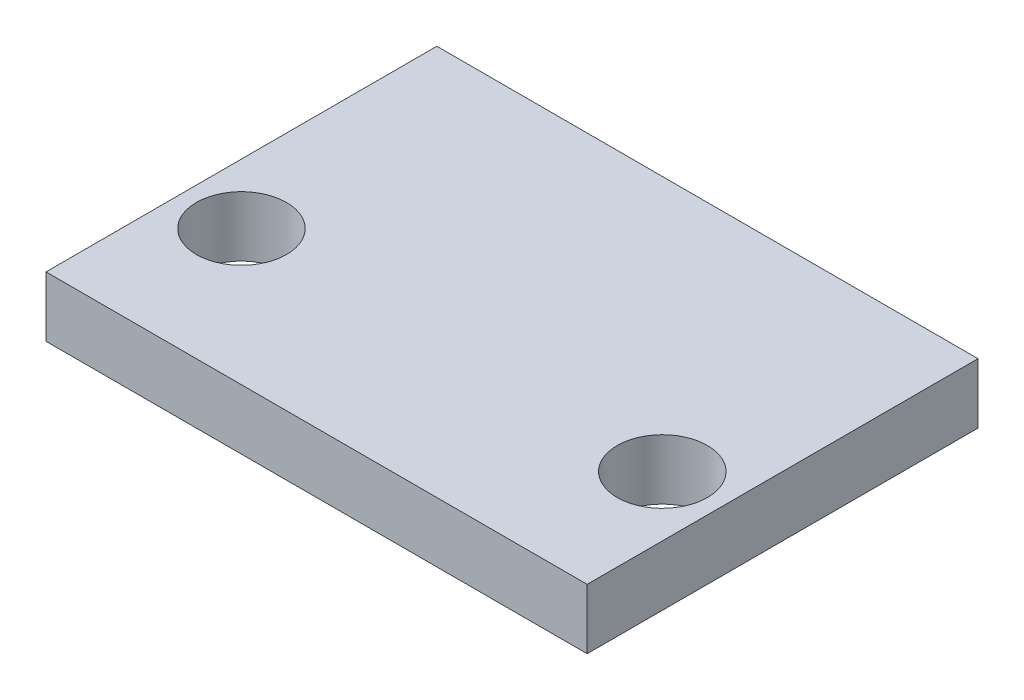
from build123d import *

# Parameters (mm, degrees)
SKETCH_1_W          = 18
SKETCH_1_H          = 13
EXTRUDE_1_DEPTH     = 2
SKETCH_3_R          = 1.5
CUT_EXTRUDE_1_DEPTH = 8


with BuildPart() as part:
    # Эскиз1 → Бобышка-Вытянуть1 (new body)
    with BuildSketch(Plane(origin=(0, 0, 0), x_dir=(1, 0, 0), z_dir=(0, 1, 0))):
        with Locations((9, -6.5)):
            Rectangle(SKETCH_1_W, SKETCH_1_H)
    extrude(amount=EXTRUDE_1_DEPTH)

    # Эскиз3 → Вырез-Вытянуть1 (cut)
    with BuildSketch(Plane.XZ):
        with Locations(Location((2, 8.5, 0), (0, 0, 270))):
            Circle(SKETCH_3_R)
        with Locations(Location((16, 8.5, 0), (0, 0, 90))):
            Circle(SKETCH_3_R)
    extrude(amount=-CUT_EXTRUDE_1_DEPTH, mode=Mode.SUBTRACT)


solid = part.part
